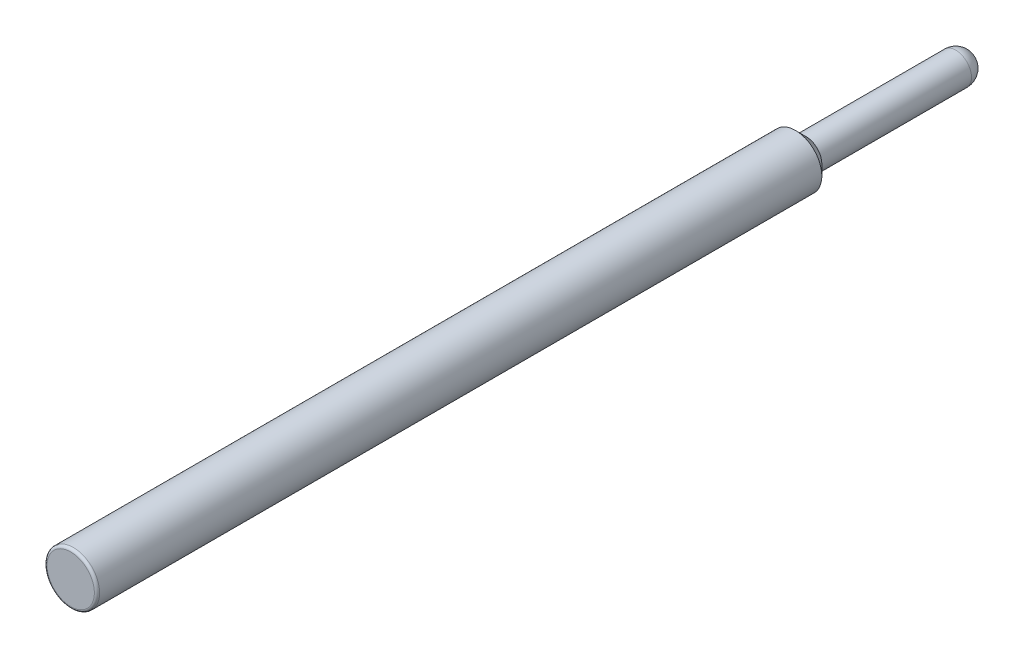
from build123d import *


with BuildPart() as part:
    # Sketch1 → Revolve1 (revolve)
    with BuildSketch(Plane(origin=(0, 0, 0), x_dir=(1, 0, 0), z_dir=(0, 1, 0)), mode=Mode.PRIVATE) as revolve1_sk:
        with BuildLine():
            Line((0, 0), (9, 0))
            ThreePointArc((9, 0), (9.707106781, 0.292893219), (10, 1))
            Line((10, 1), (10, 276))
            Line((10, 276), (6, 280))
            Line((6, 280), (6, 337))
            ThreePointArc((6, 337), (4.242640687, 341.242640687), (0, 343))
            Line((0, 343), (0, 0))
        make_face()
    revolve(revolve1_sk.sketch.rotate(Axis((0, 0, -347.378132429), (0, 0, 1)), 180), axis=Axis((0, 0, -347.378132429), (0, 0, 1)))


solid = part.part
